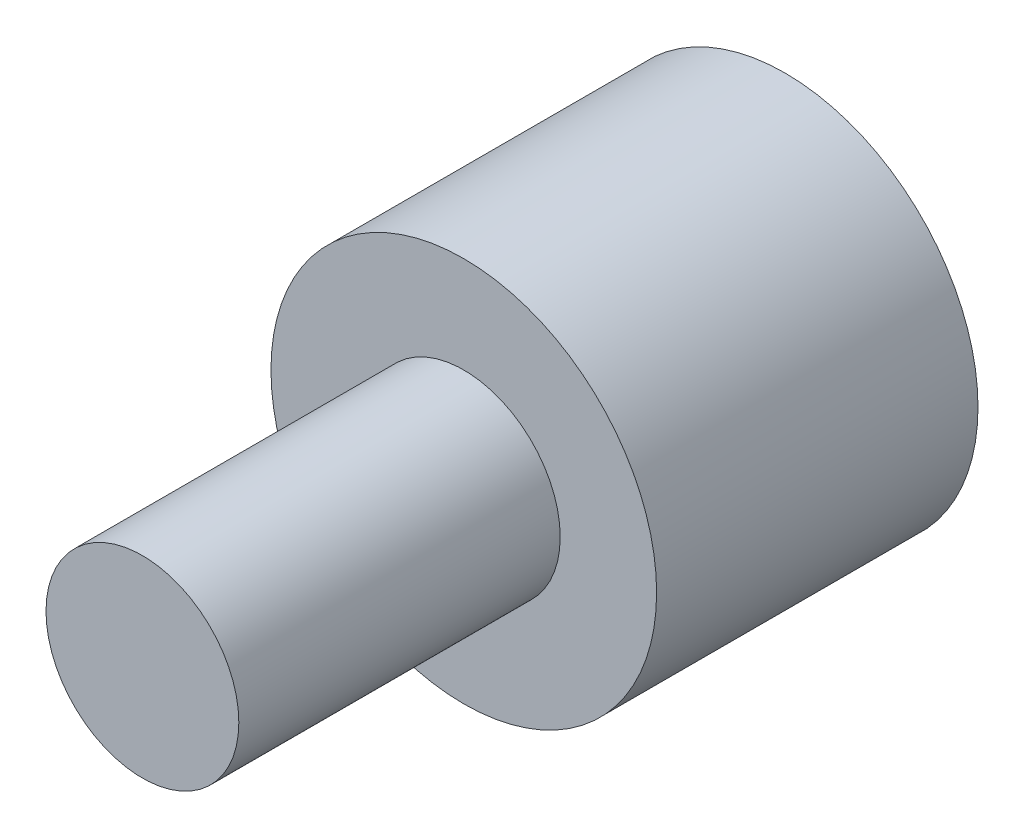
from build123d import *

# Parameters (mm, degrees)
SKETCH1_R           = 12
BOSS_EXTRUDE1_DEPTH = 20
SKETCH1_3_R         = 6
BOSS_EXTRUDE2_DEPTH = 40
SKETCH2_R           = 5
CUT_EXTRUDE1_DEPTH  = 12


with BuildPart() as part:
    # Sketch1 → Boss-Extrude1 (new body)
    with BuildSketch(Plane.XY):
        Circle(SKETCH1_R)
    extrude(amount=BOSS_EXTRUDE1_DEPTH)

    # Sketch1<3> → Boss-Extrude2 (add)
    with BuildSketch(Plane.XY):
        Circle(SKETCH1_3_R)
    extrude(amount=BOSS_EXTRUDE2_DEPTH)

    # Sketch2 → Cut-Extrude1 (cut)
    with BuildSketch(Plane(origin=(0, 0, 0), x_dir=(-1, 0, 0), z_dir=(0, 0, -1))):
        Circle(SKETCH2_R)
    extrude(amount=-CUT_EXTRUDE1_DEPTH, mode=Mode.SUBTRACT)


solid = part.part
